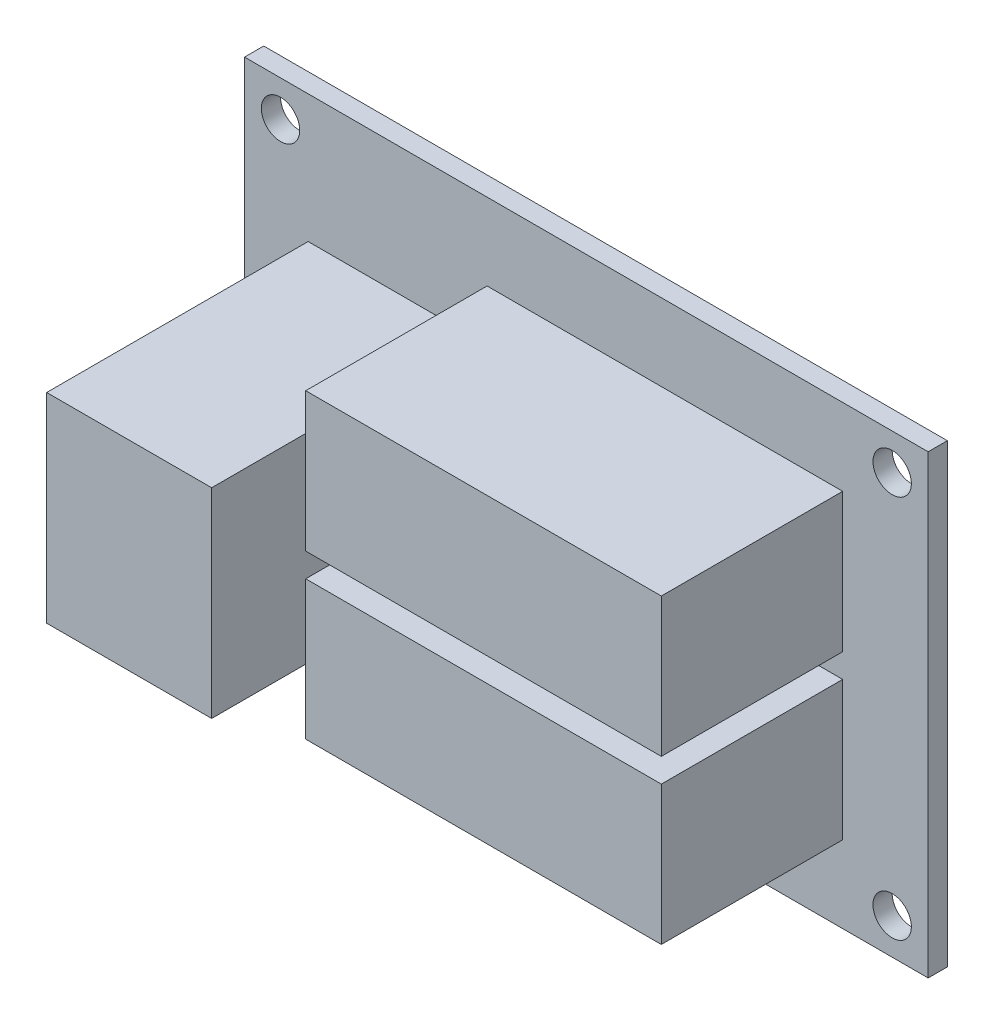
from build123d import *

# Parameters (mm, degrees)
SKETCH1_W           = 57
SKETCH1_H           = 38
SKETCH1_R           = 1.6
BOSS_EXTRUDE1_DEPTH = 1.6
SKETCH2_W           = 13.757535131
SKETCH2_H           = 16.66221661
SKETCH2_W_2         = 29.650373418
SKETCH2_H_2         = 11.582071503
BOSS_EXTRUDE2_DEPTH = 21.8
SKETCH3_W           = 29.650373418
SKETCH3_H           = 6.677072175
CUT_EXTRUDE1_DEPTH  = 49.551387626


with BuildPart() as part:
    # Sketch1 → Boss-Extrude1 (new body)
    with BuildSketch(Plane.XY):
        Rectangle(SKETCH1_W, SKETCH1_H)
        with Locations((-25.5, 16)):
            Circle(SKETCH1_R, mode=Mode.SUBTRACT)
        with Locations((-25.5, -16)):
            Circle(SKETCH1_R, mode=Mode.SUBTRACT)
        with Locations((25.5, -16)):
            Circle(SKETCH1_R, mode=Mode.SUBTRACT)
        with Locations((25.5, 16)):
            Circle(SKETCH1_R, mode=Mode.SUBTRACT)
    extrude(amount=BOSS_EXTRUDE1_DEPTH)

    # Sketch2 → Boss-Extrude2 (add)
    with BuildSketch(Plane.XY.offset(1.6)):
        with Locations((-16.320596847, 0)):
            Rectangle(SKETCH2_W, SKETCH2_H)
        with Locations((6.548865085, 6.791035752)):
            Rectangle(SKETCH2_W_2, SKETCH2_H_2)
        with Locations((6.548865085, -6.791035752)):
            Rectangle(SKETCH2_W_2, SKETCH2_H_2)
    extrude(amount=BOSS_EXTRUDE2_DEPTH)

    # Sketch3 → Cut-Extrude1 (cut, through all)
    with BuildSketch(Plane(origin=(0, -12.582071503, 0), x_dir=(-1, 0, 0), z_dir=(0, -1, 0))):
        with Locations((-6.548865085, -20.061463913)):
            Rectangle(SKETCH3_W, SKETCH3_H)
    extrude(amount=-CUT_EXTRUDE1_DEPTH, mode=Mode.SUBTRACT)


solid = part.part
